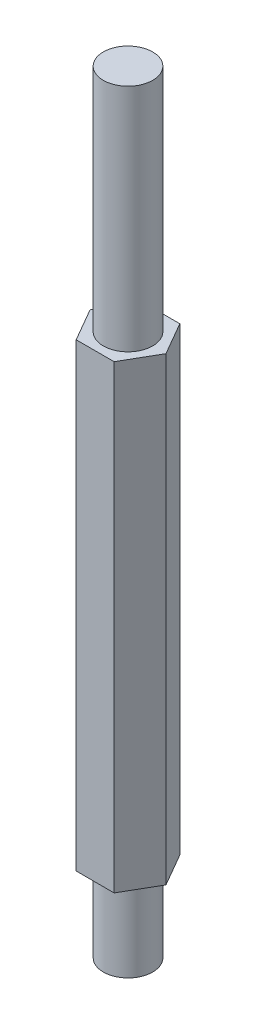
from build123d import *

# Parameters (mm, degrees)
BOSS_EXTRUDE1_DEPTH = 28
SKETCH3_R           = 1.5
BOSS_EXTRUDE2_DEPTH = 14
BOSS_EXTRUDE3_START = 5
SKETCH4_R           = 1.5
BOSS_EXTRUDE3_DEPTH = 5


with BuildPart() as part:
    # Sketch2 → Boss-Extrude1 (new body)
    with BuildSketch(Plane(origin=(0, 0, 0), x_dir=(1, 0, 0), z_dir=(0, 1, 0))):
        Polygon((-12.774681614, 6.46581124), (-13.929382153, 8.46581124), (-16.23878323, 8.46581124), (-17.393483768, 6.46581124), (-16.23878323, 4.46581124), (-13.929382153, 4.46581124), align=None)
    extrude(amount=BOSS_EXTRUDE1_DEPTH)

    # Sketch3 → Boss-Extrude2 (add)
    with BuildSketch(Plane(origin=(0, 28, 0), x_dir=(1, 0, 0), z_dir=(0, 1, 0))):
        with Locations(Location((-15.083483768, 6.46581124, 0), (0, 0, 270))):
            Circle(SKETCH3_R)
    extrude(amount=BOSS_EXTRUDE2_DEPTH)

    # Sketch4 → Boss-Extrude3 (add)
    with BuildSketch(Plane(origin=(0, 0, 0), x_dir=(-1, 0, 0), z_dir=(0, -1, 0)).offset(BOSS_EXTRUDE3_START)):
        with Locations(Location((15.083483768, 6.46581124, 0), (0, 0, 270))):
            Circle(SKETCH4_R)
    extrude(amount=-BOSS_EXTRUDE3_DEPTH)


solid = part.part
